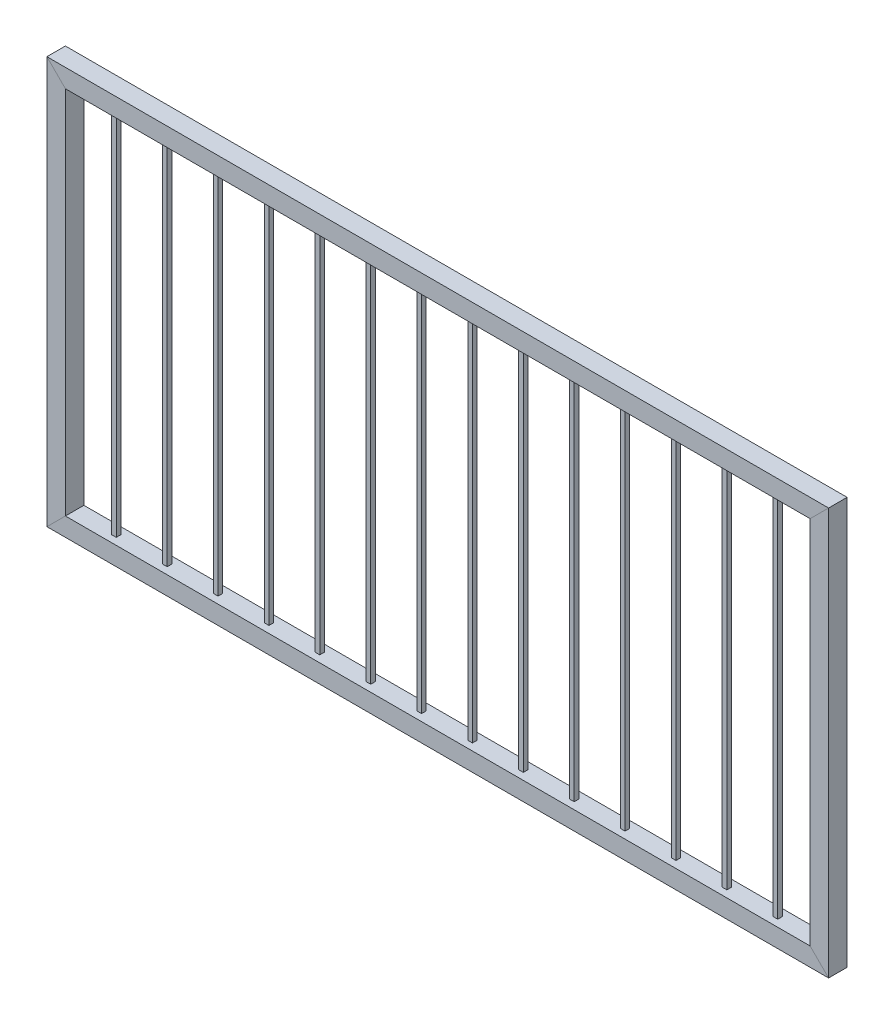
from build123d import *

# Parameters (mm, degrees)
SKETCH_1_W               = 40
SKETCH_1_H               = 40
SKETCH_2_W               = 10
SKETCH_2_H               = 10
EXTRUDE_1_DEPTH          = 800
PATTERN_LINEAR_1_COUNT   = 7
PATTERN_LINEAR_1_PITCH   = 110
MIRROR_1_COPY_1_SKETCH_W = 10
MIRROR_1_COPY_1_SKETCH_H = 10
MIRROR_1_COPY_1_DEPTH    = 800
MIRROR_1_COPY_2_SKETCH_W = 10
MIRROR_1_COPY_2_SKETCH_H = 10
MIRROR_1_COPY_2_DEPTH    = 800
MIRROR_1_COPY_3_SKETCH_W = 10
MIRROR_1_COPY_3_SKETCH_H = 10
MIRROR_1_COPY_3_DEPTH    = 800
MIRROR_1_COPY_4_SKETCH_W = 10
MIRROR_1_COPY_4_SKETCH_H = 10
MIRROR_1_COPY_4_DEPTH    = 800
MIRROR_1_COPY_5_SKETCH_W = 10
MIRROR_1_COPY_5_SKETCH_H = 10
MIRROR_1_COPY_5_DEPTH    = 800
MIRROR_1_COPY_6_SKETCH_W = 10
MIRROR_1_COPY_6_SKETCH_H = 10
MIRROR_1_COPY_6_DEPTH    = 800


with BuildPart() as part:
    # По траектории1: sweep along a curve in space
    with BuildLine() as sweep_1_path:
        Line((0, 0, 0), (0, 840, 0))
        Line((0, 840, 0), (1650, 840, 0))
        Line((1650, 0, 0), (1650, 840, 0))
        Line((0, 0, 0), (1650, 0, 0))
    # Эскиз1 → По траектории1 (sweep)
    with BuildSketch(Plane(origin=(0, 0, 0), x_dir=(1, 0, 0), z_dir=(0, 1, 0))):
        Rectangle(SKETCH_1_W, SKETCH_1_H)
    sweep(path=sweep_1_path.line, transition=Transition.RIGHT)

    # Эскиз2 → Бобышка-Вытянуть1 (add)
    with BuildSketch(Plane(origin=(0, 20, 0), x_dir=(1, 0, 0), z_dir=(0, 1, 0))):
        with Locations((770, 0)):
            Rectangle(SKETCH_2_W, SKETCH_2_H)
    extrude_1 = extrude(amount=EXTRUDE_1_DEPTH)

    # Линейный массив1: Бобышка-Вытянуть1 ×7
    with Locations(*[(-i * PATTERN_LINEAR_1_PITCH, 0, 0) for i in range(1, PATTERN_LINEAR_1_COUNT)]):
        add(extrude_1)

    # Зеркальное отражение1: Бобышка-Вытянуть1 across plane
    add(extrude_1.mirror(Plane.ZY.offset(-825)))

    # Зеркальное отражение1 copy 1 sketch → Зеркальное отражение1 copy 1 (add)
    with BuildSketch(Plane(origin=(1760, 20, 0), x_dir=(-1, 0, 0), z_dir=(0, 1, 0))):
        with Locations((770, 0)):
            Rectangle(MIRROR_1_COPY_1_SKETCH_W, MIRROR_1_COPY_1_SKETCH_H)
    extrude(amount=MIRROR_1_COPY_1_DEPTH)

    # Зеркальное отражение1 copy 2 sketch → Зеркальное отражение1 copy 2 (add)
    with BuildSketch(Plane(origin=(1870, 20, 0), x_dir=(-1, 0, 0), z_dir=(0, 1, 0))):
        with Locations((770, 0)):
            Rectangle(MIRROR_1_COPY_2_SKETCH_W, MIRROR_1_COPY_2_SKETCH_H)
    extrude(amount=MIRROR_1_COPY_2_DEPTH)

    # Зеркальное отражение1 copy 3 sketch → Зеркальное отражение1 copy 3 (add)
    with BuildSketch(Plane(origin=(1980, 20, 0), x_dir=(-1, 0, 0), z_dir=(0, 1, 0))):
        with Locations((770, 0)):
            Rectangle(MIRROR_1_COPY_3_SKETCH_W, MIRROR_1_COPY_3_SKETCH_H)
    extrude(amount=MIRROR_1_COPY_3_DEPTH)

    # Зеркальное отражение1 copy 4 sketch → Зеркальное отражение1 copy 4 (add)
    with BuildSketch(Plane(origin=(2090, 20, 0), x_dir=(-1, 0, 0), z_dir=(0, 1, 0))):
        with Locations((770, 0)):
            Rectangle(MIRROR_1_COPY_4_SKETCH_W, MIRROR_1_COPY_4_SKETCH_H)
    extrude(amount=MIRROR_1_COPY_4_DEPTH)

    # Зеркальное отражение1 copy 5 sketch → Зеркальное отражение1 copy 5 (add)
    with BuildSketch(Plane(origin=(2200, 20, 0), x_dir=(-1, 0, 0), z_dir=(0, 1, 0))):
        with Locations((770, 0)):
            Rectangle(MIRROR_1_COPY_5_SKETCH_W, MIRROR_1_COPY_5_SKETCH_H)
    extrude(amount=MIRROR_1_COPY_5_DEPTH)

    # Зеркальное отражение1 copy 6 sketch → Зеркальное отражение1 copy 6 (add)
    with BuildSketch(Plane(origin=(2310, 20, 0), x_dir=(-1, 0, 0), z_dir=(0, 1, 0))):
        with Locations((770, 0)):
            Rectangle(MIRROR_1_COPY_6_SKETCH_W, MIRROR_1_COPY_6_SKETCH_H)
    extrude(amount=MIRROR_1_COPY_6_DEPTH)


solid = part.part
